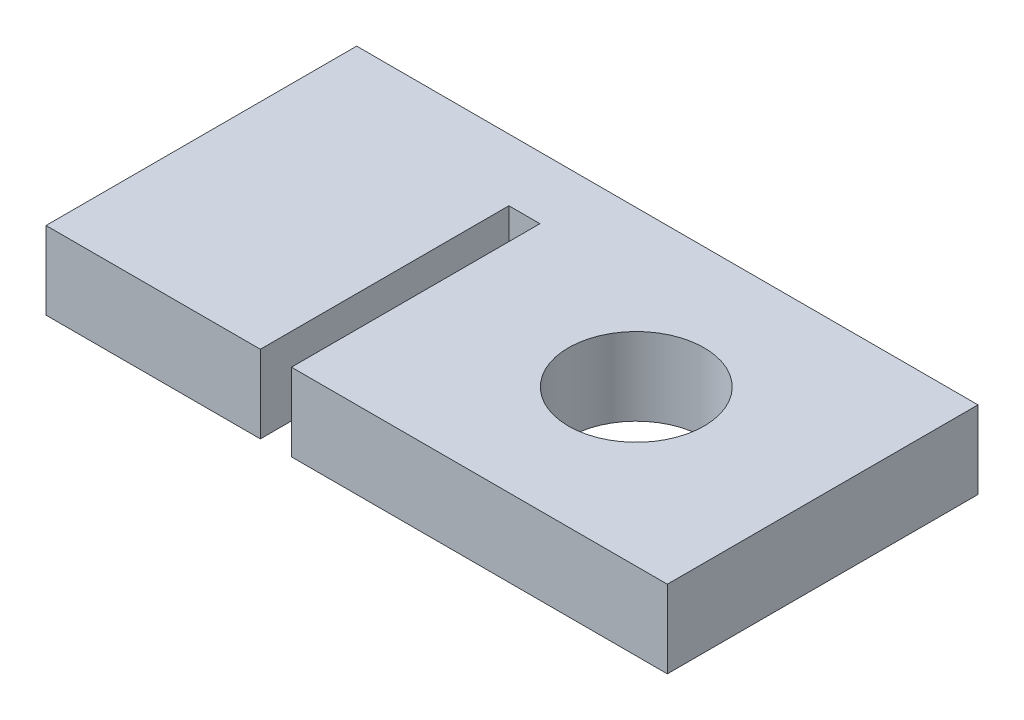
from build123d import *

# Parameters (mm, degrees)
BOSS_EXTRUDE1_DEPTH = 1.25
SKETCH5_R           = 1.0922
CUT_EXTRUDE1_DEPTH  = 6.728219619


with BuildPart() as part:
    # Sketch1 → Boss-Extrude1 (new body)
    with BuildSketch(Plane(origin=(0, 0, 0), x_dir=(1, 0, 0), z_dir=(0, 1, 0))):
        Polygon((-1.05, -2.5), (5, -2.5), (5, 2.5), (-5, 2.5), (-5, -2.5), (-1.55, -2.5), (-1.55, 1.5), (-1.05, 1.5), align=None)
    extrude(amount=BOSS_EXTRUDE1_DEPTH)

    # Sketch5 → Cut-Extrude1 (cut, through all)
    with BuildSketch(Plane(origin=(0, 1.25, 0), x_dir=(1, 0, 0), z_dir=(0, 1, 0))):
        with Locations(Location((2, 0, 0), (0, 0, 270))):
            Circle(SKETCH5_R)
    extrude(amount=-CUT_EXTRUDE1_DEPTH, mode=Mode.SUBTRACT)


solid = part.part
